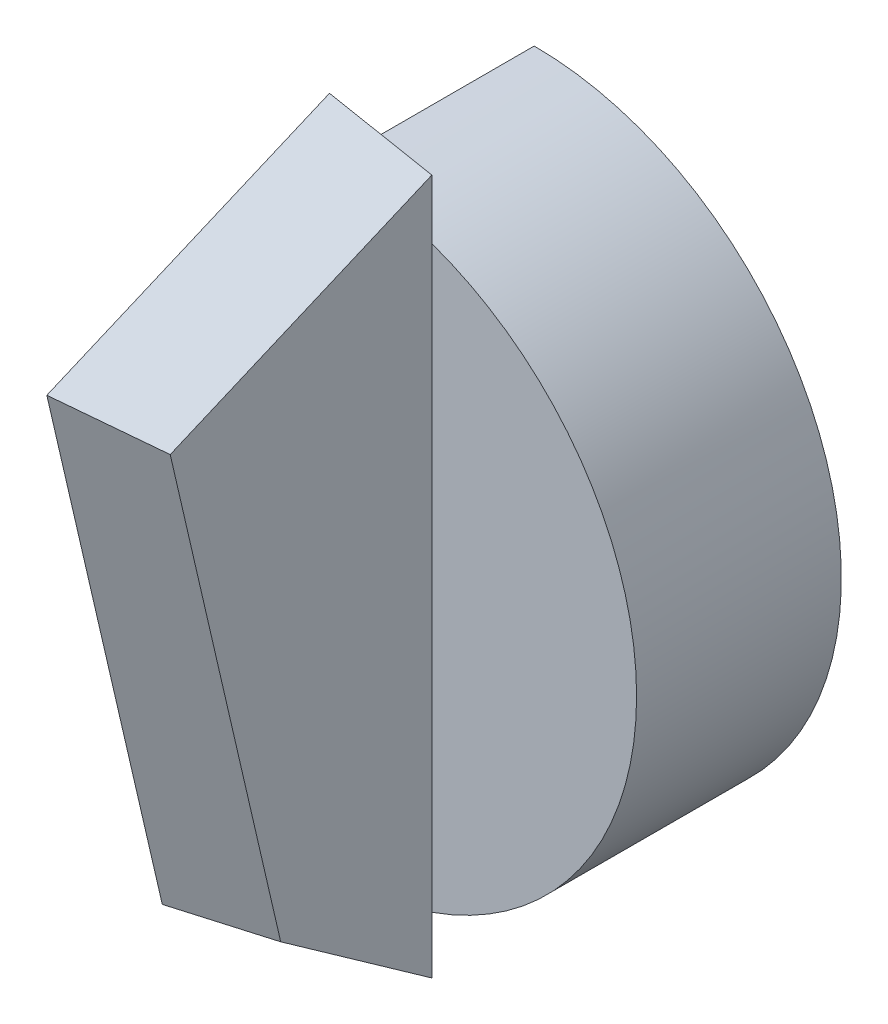
from build123d import *

# Parameters (mm, degrees)
EXTRUDE1_DEPTH = 10
EXTRUDE2_DEPTH = 5
DRAFT1_ANGLE   = 10


with BuildPart() as part:
    # Sketch1 → Extrude1 (new body)
    with BuildSketch(Plane.XY):
        with BuildLine():
            Line((0, 15), (0, -15))
            ThreePointArc((0, -15), (15, 0), (0, 15))
        make_face()
    extrude(amount=EXTRUDE1_DEPTH)

    # Sketch2 → Extrude2 (add)
    with BuildSketch(Plane(origin=(0, 0, 0), x_dir=(0, 0, -1), z_dir=(1, 0, 0))):
        Polygon((-10, 18), (-10, -18), (-18.164261824, -12.225501851), (-23.803781668, 12.130109739), align=None)
    extrude(amount=EXTRUDE2_DEPTH)

    # Draft1
    draft1_faces = [part.faces().sort_by_distance(p)[0] for p in [
        (2.5, -15.112750925, 14.082130912),
        (2.5, -0.047696056, 20.984021746),
        (2.5, 15.06505487, 16.901890834),
    ]]
    draft(draft1_faces, Plane(origin=(0, 0, 0), x_dir=(0, 0, 1), z_dir=(1, 0, 0)), DRAFT1_ANGLE)


solid = part.part
